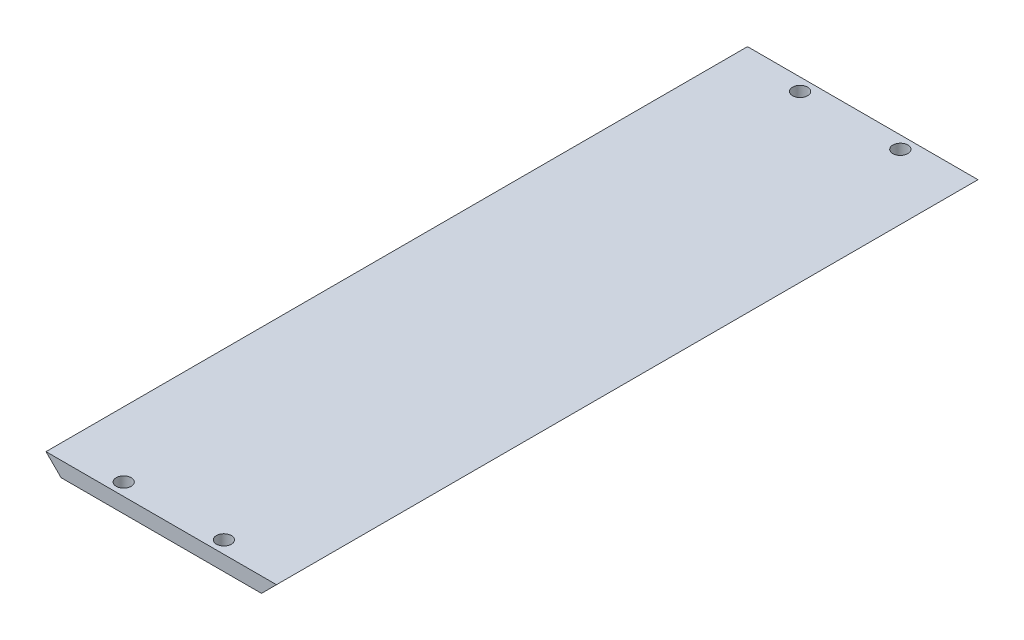
from build123d import *

# Parameters (mm, degrees)
SKETCH1_W           = 50
SKETCH1_H           = 140
BOSS_EXTRUDE2_DEPTH = 5
CUT_EXTRUDE1_DEPTH  = 152
SKETCH7_W           = 50
SKETCH7_H           = 2
CUT_EXTRUDE5_DEPTH  = 197
SKETCH8_W           = 30
SKETCH8_H           = 130
CUT_EXTRUDE6_DEPTH  = 197
SKETCH9_W           = 40
SKETCH9_H           = 20
SKETCH9_R           = 1.5
BOSS_EXTRUDE5_DEPTH = 3
SKETCH10_W          = 30
SKETCH10_H          = 10
SKETCH10_R          = 1.5
BOSS_EXTRUDE6_DEPTH = 3
SKETCH11_R          = 1.5
CUT_EXTRUDE7_DEPTH  = 3
SKETCH12_W          = 30.040139405
SKETCH12_H          = 126.520437971
BOSS_EXTRUDE8_DEPTH = 3


with BuildPart() as part:
    # Sketch1 → Boss-Extrude2 (new body)
    with BuildSketch(Plane(origin=(0, 0, 0), x_dir=(1, 0, 0), z_dir=(0, 1, 0))):
        Rectangle(SKETCH1_W, SKETCH1_H)
    extrude(amount=BOSS_EXTRUDE2_DEPTH)

    # Sketch2 → Cut-Extrude1 (cut)
    with BuildSketch(Plane.XY.offset(70)):
        Polygon((-20, 0), (-25, 5), (-25, 0), align=None)
        Polygon((25, 5), (20, 0), (25, 0), align=None)
    extrude(amount=-CUT_EXTRUDE1_DEPTH, mode=Mode.SUBTRACT)

    # Sketch7 → Cut-Extrude5 (cut)
    with BuildSketch(Plane(origin=(0, 0, -70), x_dir=(-1, 0, 0), z_dir=(0, 0, -1))):
        with Locations((0, 4)):
            Rectangle(SKETCH7_W, SKETCH7_H)
    extrude(amount=-CUT_EXTRUDE5_DEPTH, mode=Mode.SUBTRACT)

    # Sketch8 → Cut-Extrude6 (cut)
    with BuildSketch(Plane.XZ):
        Rectangle(SKETCH8_W, SKETCH8_H)
    extrude(amount=-CUT_EXTRUDE6_DEPTH, mode=Mode.SUBTRACT)

    # Sketch9 → Boss-Extrude5 (add)
    with BuildSketch(Plane.XZ):
        with Locations((0, -60)):
            Rectangle(SKETCH9_W, SKETCH9_H)
        with Locations(Location((-13.5, -56.5, 0), (0, 0, 270))):
            Circle(SKETCH9_R, mode=Mode.SUBTRACT)
        with Locations(Location((13.5, -56.5, 0), (0, 0, 90))):
            Circle(SKETCH9_R, mode=Mode.SUBTRACT)
    extrude(amount=-BOSS_EXTRUDE5_DEPTH)

    # Sketch10 → Boss-Extrude6 (add)
    with BuildSketch(Plane.XZ):
        with Locations((0, 50)):
            Rectangle(SKETCH10_W, SKETCH10_H)
        with Locations(Location((-10, 50, 0), (0, 0, 270))):
            Circle(SKETCH10_R, mode=Mode.SUBTRACT)
        with Locations(Location((10, 50, 0), (0, 0, 270))):
            Circle(SKETCH10_R, mode=Mode.SUBTRACT)
    extrude(amount=-BOSS_EXTRUDE6_DEPTH)

    # Sketch11 → Cut-Extrude7 (cut)
    with BuildSketch(Plane.XZ):
        with Locations(Location((-10, 67.5, 0), (0, 0, 270))):
            Circle(SKETCH11_R)
        with Locations(Location((10, 67.5, 0), (0, 0, 90))):
            Circle(SKETCH11_R)
        with Locations(Location((10, -67.5, 0), (0, 0, 270))):
            Circle(SKETCH11_R)
        with Locations(Location((-10, -67.5, 0), (0, 0, 90))):
            Circle(SKETCH11_R)
    extrude(amount=-CUT_EXTRUDE7_DEPTH, mode=Mode.SUBTRACT)

    # Sketch12 → Boss-Extrude8 (add)
    with BuildSketch(Plane(origin=(0, 3, 0), x_dir=(1, 0, 0), z_dir=(0, 1, 0))):
        with Locations((-0.020069702, -1.739781014)):
            Rectangle(SKETCH12_W, SKETCH12_H)
    extrude(amount=-BOSS_EXTRUDE8_DEPTH)


solid = part.part
